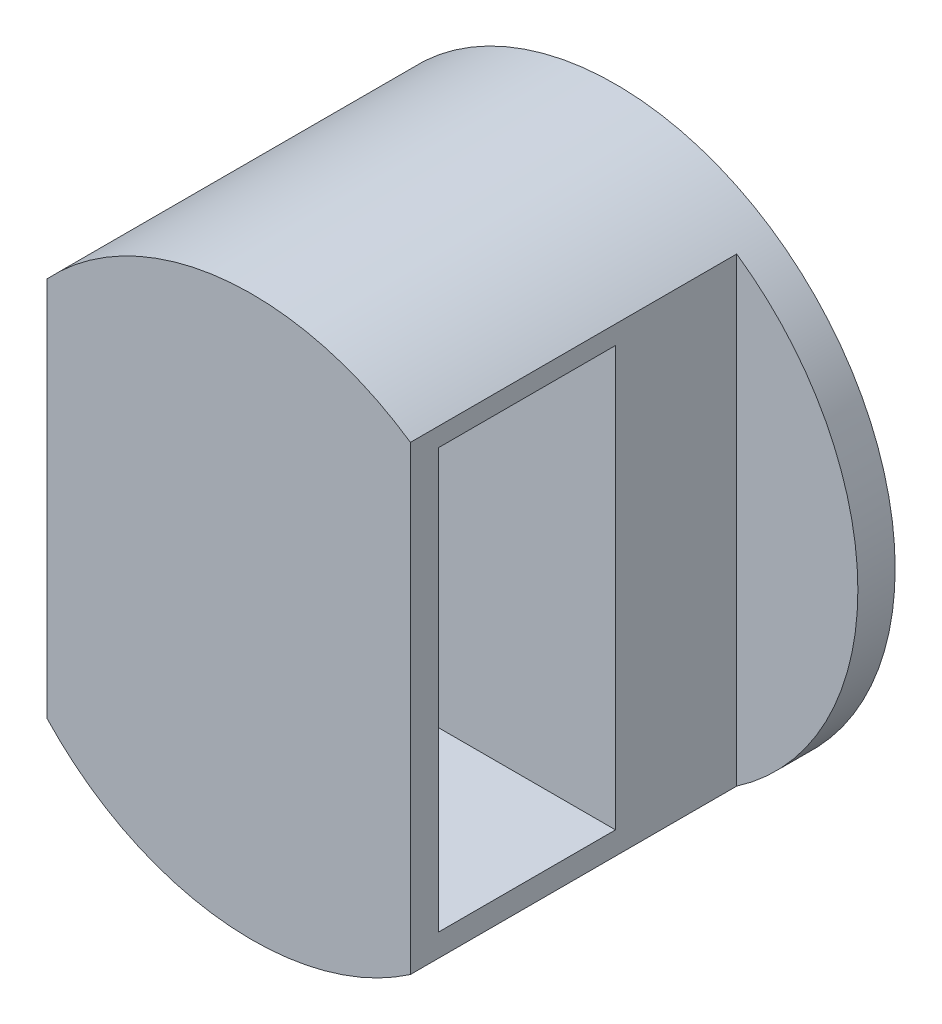
from build123d import *

# Parameters (mm, degrees)
ESQUISSE1_R             = 30
BOSS_EXTRU_1_DEPTH      = 4
BOSS_EXTRU_3_DEPTH      = 35
ESQUISSE7_W             = 19
ESQUISSE7_H             = 45
ENL_V_MAT_EXTRU_1_DEPTH = 30
ESQUISSE8_R             = 1.001210448
ENL_V_MAT_EXTRU_2_DEPTH = 2


with BuildPart() as part:
    # Esquisse1 → Boss.-Extru.1 (new body)
    with BuildSketch(Plane.XY):
        with Locations((-21.677103804, 21.48828033)):
            Circle(ESQUISSE1_R)
    extrude(amount=BOSS_EXTRU_1_DEPTH)

    # Esquisse4 → Boss.-Extru.3 (add)
    with BuildSketch(Plane.XY.offset(4)):
        with BuildLine():
            Line((-43.677103804, 41.884358384), (-43.677103804, 21.48828033))
            Line((-43.677103804, 21.48828033), (-43.677103804, 1.092202275))
            ThreePointArc((-43.677103804, 1.092202275), (-24.981744089, -8.329153372), (-4.677103804, -3.230133859))
            Line((-4.677103804, -3.230133859), (-4.677103804, 46.206694518))
            ThreePointArc((-4.677103804, 46.206694518), (-24.981744089, 51.305714032), (-43.677103804, 41.884358384))
        make_face()
    extrude(amount=BOSS_EXTRU_3_DEPTH)

    # Esquisse7 → Enlèv. mat.-Extru.1 (cut)
    with BuildSketch(Plane(origin=(-4.677103804, 0, 0), x_dir=(0, 0, -1), z_dir=(1, 0, 0))):
        with Locations((-26.5, 21.706694518)):
            Rectangle(ESQUISSE7_W, ESQUISSE7_H)
    extrude(amount=-ENL_V_MAT_EXTRU_1_DEPTH, mode=Mode.SUBTRACT)

    # Esquisse8 → Enlèv. mat.-Extru.2 (cut)
    with BuildSketch(Plane(origin=(0, 0, 0), x_dir=(-1, 0, 0), z_dir=(0, 0, -1))):
        with Locations((21.677103804, 21.48828033)):
            Circle(ESQUISSE8_R)
    extrude(amount=-ENL_V_MAT_EXTRU_2_DEPTH, mode=Mode.SUBTRACT)


solid = part.part
